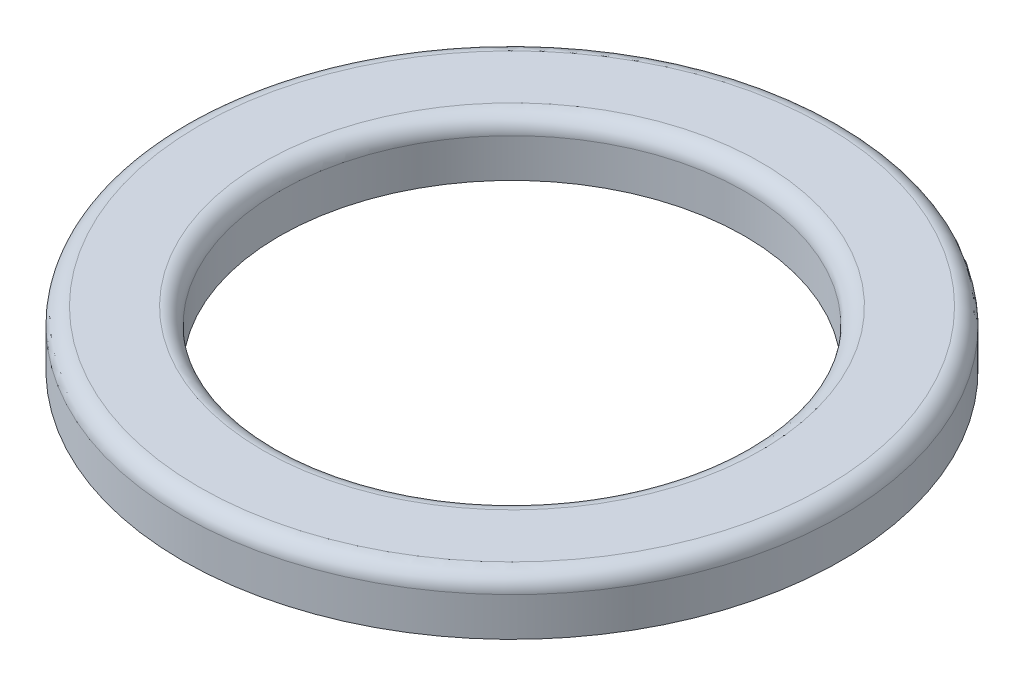
from build123d import *

# Parameters (mm, degrees)
SKETCH1_R           = 5.95
SKETCH1_R_2         = 4.2
BOSS_EXTRUDE1_DEPTH = 1
FILLET1_R           = 0.3


with BuildPart() as part:
    # Sketch1 → Boss-Extrude1 (new body)
    with BuildSketch(Plane(origin=(0, 0, 0), x_dir=(1, 0, 0), z_dir=(0, 1, 0))):
        with Locations(Location((0, 0, 0), (0, 0, 270))):
            Circle(SKETCH1_R)
        with Locations(Location((0, 0, 0), (0, 0, 270))):
            Circle(SKETCH1_R_2, mode=Mode.SUBTRACT)
    extrude(amount=BOSS_EXTRUDE1_DEPTH)

    # Fillet1
    fillet1_edges = [part.edges().sort_by_distance(p)[0] for p in [
        (0, 1, -5.95),
        (0, 1, -4.2),
    ]]
    fillet(fillet1_edges, radius=FILLET1_R)


solid = part.part
